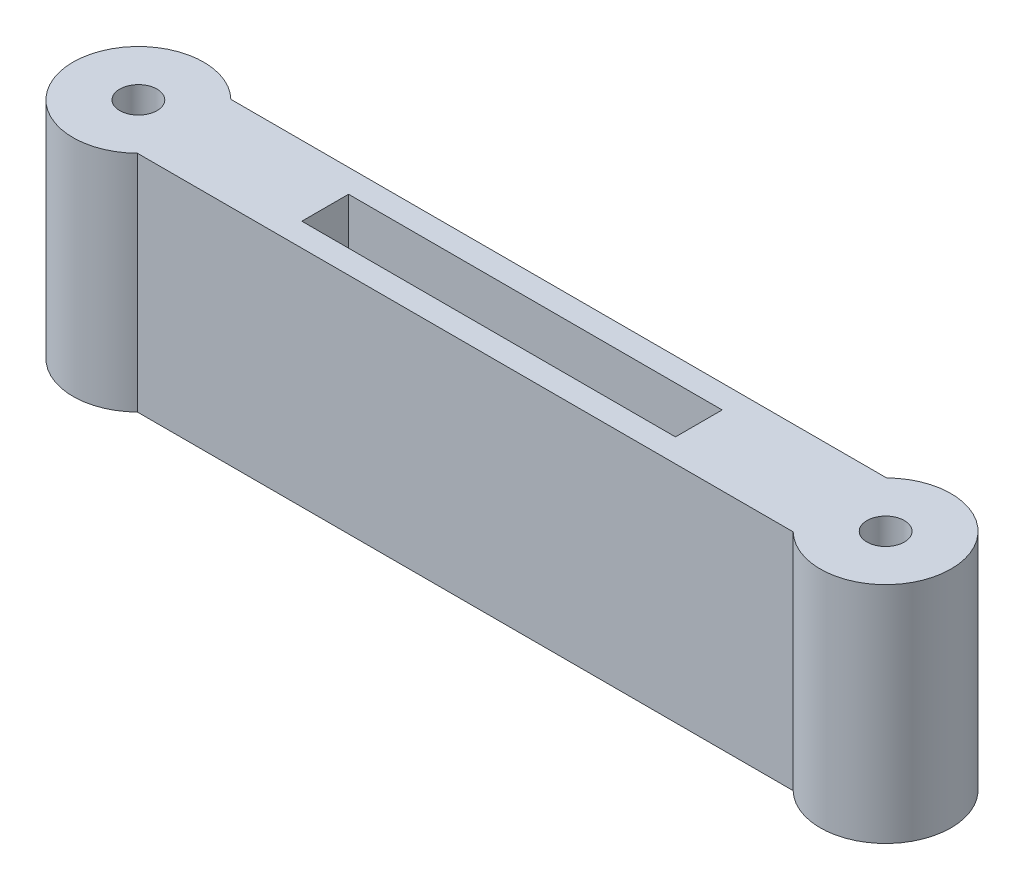
from build123d import *

# Parameters (mm, degrees)
BOSS_EXTRUDE1_DEPTH      = 60
BOSS_EXTRUDE1_DEPTH_BACK = 60
SKETCH1_W                = 400
SKETCH1_H                = 50
BOSS_EXTRUDE2_DEPTH      = 60
BOSS_EXTRUDE2_DEPTH_BACK = 60
SKETCH2_R                = 35
CUT_EXTRUDE1_DEPTH       = 60
CUT_EXTRUDE1_DEPTH_BACK  = 60
SKETCH3_R                = 10
CUT_EXTRUDE2_DEPTH       = 60
CUT_EXTRUDE2_DEPTH_BACK  = 60
SKETCH4_W                = 200
SKETCH4_H                = 25


with BuildPart() as part:
    # Sketch1 → Boss-Extrude1 (new, two sides: drawn at the far end of the back side and taken through both)
    with BuildSketch(Plane(origin=(0, 0, 0), x_dir=(1, 0, 0), z_dir=(0, 1, 0)).offset(-BOSS_EXTRUDE1_DEPTH_BACK)):
        with Locations((200, 0)):
            Rectangle(SKETCH1_W, SKETCH1_H)
    extrude(amount=BOSS_EXTRUDE1_DEPTH + BOSS_EXTRUDE1_DEPTH_BACK)

    # Sketch2 → Boss-Extrude2 (add, two sides: drawn at the far end of the back side and taken through both)
    with BuildSketch(Plane(origin=(0, 0, 0), x_dir=(1, 0, 0), z_dir=(0, 1, 0)).offset(-BOSS_EXTRUDE2_DEPTH_BACK)):
        Circle(SKETCH2_R)
        with Locations((400, 0)):
            Circle(SKETCH2_R)
    extrude(amount=BOSS_EXTRUDE2_DEPTH + BOSS_EXTRUDE2_DEPTH_BACK)

    # Sketch3 → Cut-Extrude1 (cut, two sides: drawn at the far end of the back side and taken through both)
    with BuildSketch(Plane(origin=(0, 0, 0), x_dir=(1, 0, 0), z_dir=(0, 1, 0)).offset(-CUT_EXTRUDE1_DEPTH_BACK)):
        Circle(SKETCH3_R)
        with Locations((400, 0)):
            Circle(SKETCH3_R)
    extrude(amount=CUT_EXTRUDE1_DEPTH + CUT_EXTRUDE1_DEPTH_BACK, mode=Mode.SUBTRACT)

    # Sketch4 → Cut-Extrude2 (cut, two sides: drawn at the far end of the back side and taken through both)
    with BuildSketch(Plane(origin=(0, 0, 0), x_dir=(1, 0, 0), z_dir=(0, 1, 0)).offset(-CUT_EXTRUDE2_DEPTH_BACK)):
        with Locations((200, 0)):
            Rectangle(SKETCH4_W, SKETCH4_H)
    extrude(amount=CUT_EXTRUDE2_DEPTH + CUT_EXTRUDE2_DEPTH_BACK, mode=Mode.SUBTRACT)


solid = part.part
